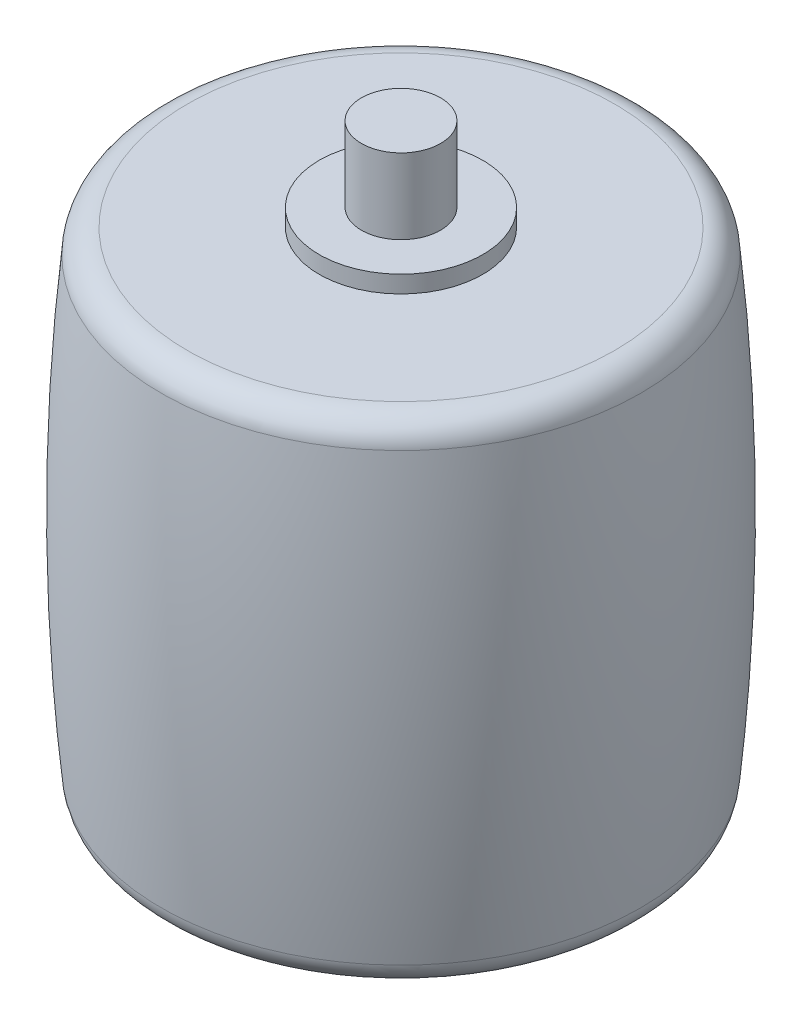
from build123d import *

# Parameters (mm, degrees)
FILLET_1_R = 1


with BuildPart() as part:
    # 草图1 → 旋转1 (revolve)
    with BuildSketch(Plane.XY, mode=Mode.PRIVATE) as revolve_1_sk:
        with BuildLine():
            Line((0, 12.85), (0, -12.85))
            Line((0, -12.85), (1.5, -12.85))
            Line((1.5, -12.85), (1.5, -10))
            Line((1.5, -10), (3.1, -10))
            Line((3.1, -10), (3.1, -9.35))
            Line((3.1, -9.35), (9, -9.35))
            ThreePointArc((9, -9.35), (9.5, 0), (9, 9.35))
            Line((9, 9.35), (3.1, 9.35))
            Line((3.1, 9.35), (3.1, 10))
            Line((3.1, 10), (1.5, 10))
            Line((1.5, 10), (1.5, 12.85))
            Line((1.5, 12.85), (0, 12.85))
        make_face()
    revolve(revolve_1_sk.sketch.rotate(Axis((0, 12.85, 0), (0, -1, 0)), 180), axis=Axis((0, 12.85, 0), (0, -1, 0)))

    # 圆角1
    fillet_1_edges = [part.edges().sort_by_distance(p)[0] for p in [
        (9, -9.35, 0),
        (9, 9.35, 0),
    ]]
    fillet(fillet_1_edges, radius=FILLET_1_R)


solid = part.part
